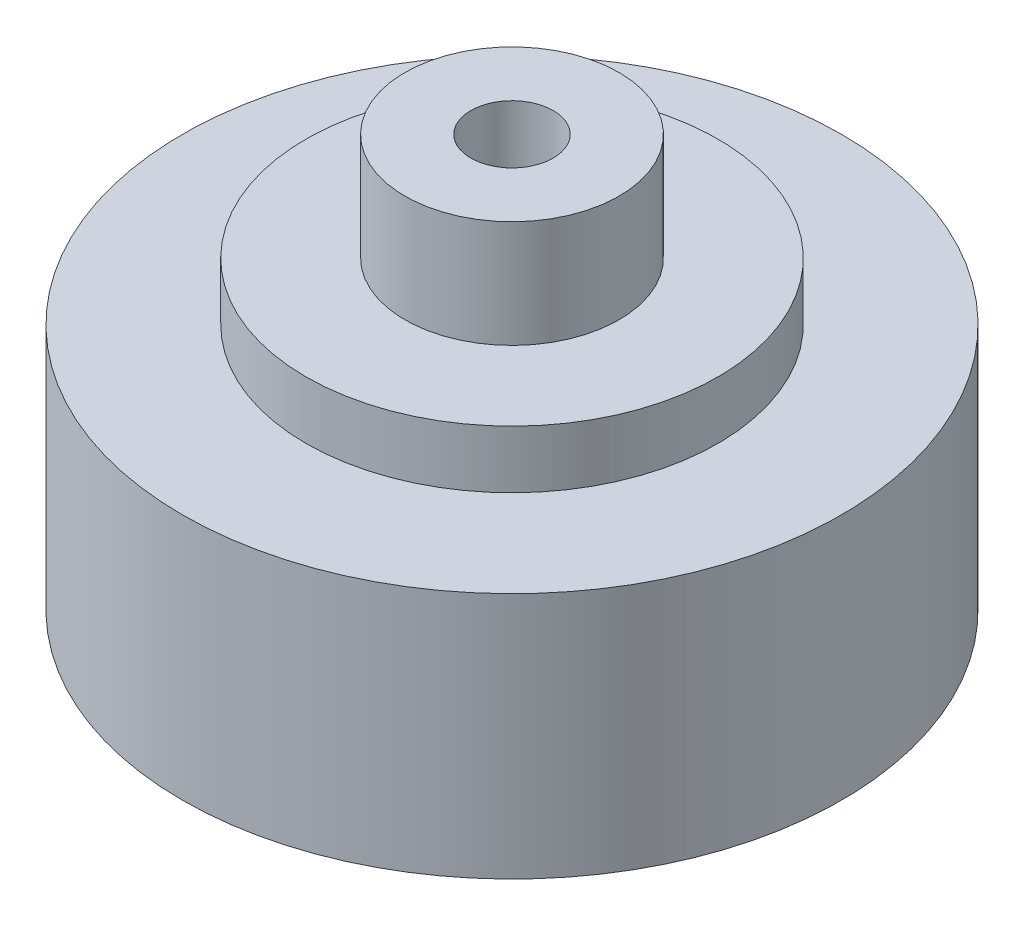
from build123d import *

# Parameters (mm, degrees)
SKETCH1_R           = 40
BOSS_EXTRUDE1_DEPTH = 30
SKETCH2_R           = 25
BOSS_EXTRUDE3_DEPTH = 7
SKETCH3_R           = 13
BOSS_EXTRUDE4_DEPTH = 13
SKETCH4_R           = 5
CUT_EXTRUDE2_DEPTH  = 50


with BuildPart() as part:
    # Sketch1 → Boss-Extrude1 (new body)
    with BuildSketch(Plane(origin=(0, 0, 0), x_dir=(1, 0, 0), z_dir=(0, 1, 0))):
        with Locations(Location((0, 0, 0), (0, 0, 270))):
            Circle(SKETCH1_R)
    extrude(amount=BOSS_EXTRUDE1_DEPTH)


with BuildPart() as body_2:
    # Sketch2 → Boss-Extrude3 (new body)
    with BuildSketch(Plane(origin=(0, 30, 0), x_dir=(1, 0, 0), z_dir=(0, 1, 0))):
        with Locations(Location((0, 0, 0), (0, 0, 270))):
            Circle(SKETCH2_R)
    extrude(amount=BOSS_EXTRUDE3_DEPTH)

    # Sketch3 → Boss-Extrude4 (add)
    with BuildSketch(Plane(origin=(0, 37, 0), x_dir=(1, 0, 0), z_dir=(0, 1, 0))):
        with Locations(Location((0, 0, 0), (0, 0, 90))):
            Circle(SKETCH3_R)
    extrude(amount=BOSS_EXTRUDE4_DEPTH)


with BuildPart() as cut_extrude2_tool:
    # Sketch4 → Cut-Extrude2 (new body)
    with BuildSketch(Plane.XZ):
        with Locations(Location((0, 0, 0), (0, 0, 270))):
            Circle(SKETCH4_R)
    extrude(amount=-CUT_EXTRUDE2_DEPTH)


with BuildPart() as part_1:
    add(part.part)

    # Cut-Extrude2: cut by cut_extrude2_tool
    add(cut_extrude2_tool.part, mode=Mode.SUBTRACT)


with BuildPart() as body_2_1:
    add(body_2.part)

    # Cut-Extrude2: cut by cut_extrude2_tool
    add(cut_extrude2_tool.part, mode=Mode.SUBTRACT)


solid = Compound([part_1.part, body_2_1.part])
